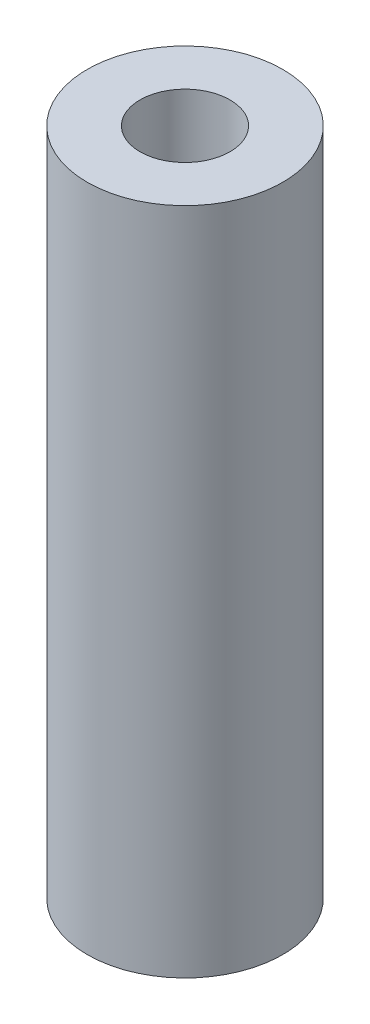
from build123d import *

# Parameters (mm, degrees)
SKETCH1_R           = 5
SKETCH1_R_2         = 2.3
BOSS_EXTRUDE1_DEPTH = 34.2


with BuildPart() as part:
    # Sketch1 → Boss-Extrude1 (new body)
    with BuildSketch(Plane(origin=(0, 0, 0), x_dir=(1, 0, 0), z_dir=(0, 1, 0))):
        with Locations(Location((0, 0, 0), (0, 0, 270))):
            Circle(SKETCH1_R)
        with Locations(Location((0, 0, 0), (0, 0, 270))):
            Circle(SKETCH1_R_2, mode=Mode.SUBTRACT)
    extrude(amount=BOSS_EXTRUDE1_DEPTH)


solid = part.part
